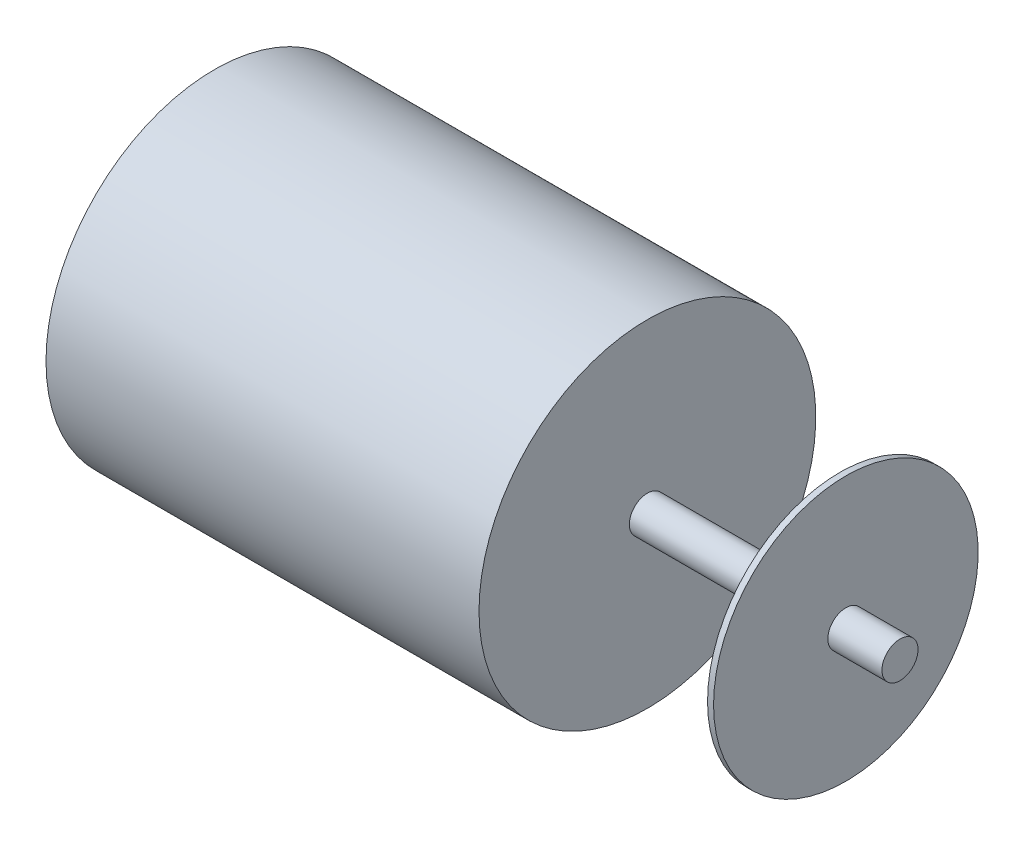
from build123d import *


with BuildPart() as part:
    # Sketch3 → Revolve1 (revolve)
    with BuildSketch(Plane.XY, mode=Mode.PRIVATE) as revolve1_sk:
        Polygon((0, 0), (57, 0), (57, 1.5), (52.5, 1.5), (52.5, 11), (52, 11), (52, 1.5), (36, 1.5), (36, 14), (0, 14), align=None)
    revolve(revolve1_sk.sketch.rotate(Axis((0, 0, 0), (1, 0, 0)), 90), axis=Axis((0, 0, 0), (1, 0, 0)))


solid = part.part
